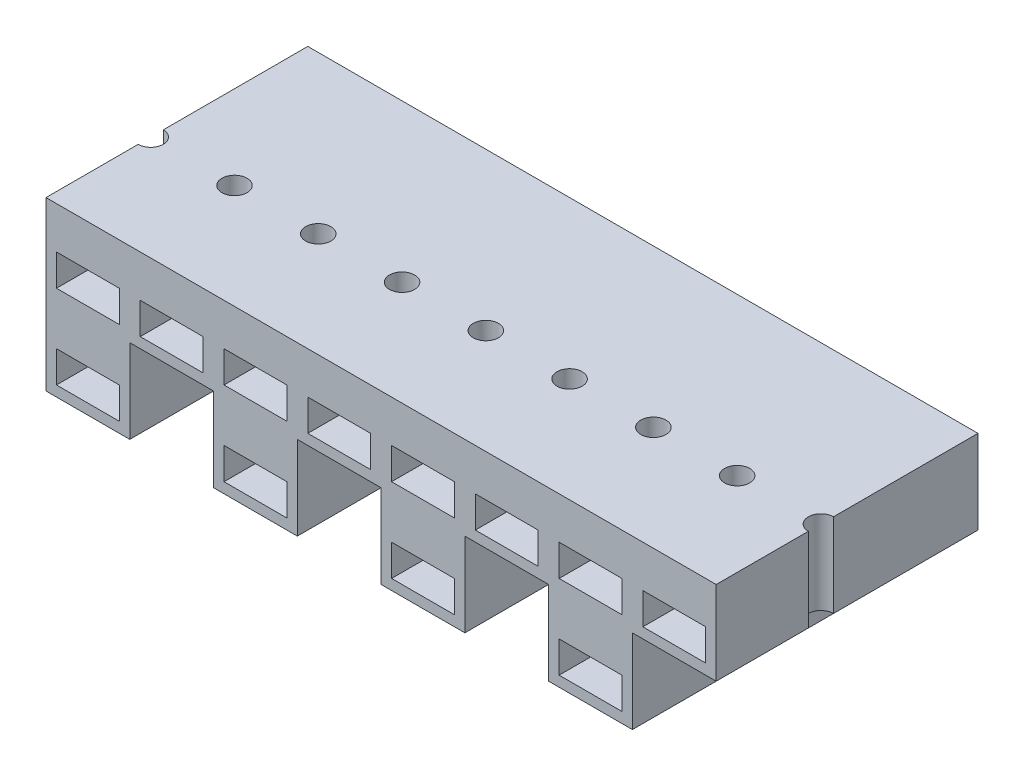
from build123d import *

# Parameters (mm, degrees)
BOSS_EXTRUDE1_DEPTH      = 10
BOSS_EXTRUDE1_DEPTH_BACK = 15
SKETCH2_R                = 1.2
CUT_EXTRUDE1_DEPTH       = 39.794329483
LPATTERN1_COUNT          = 9
LPATTERN1_PITCH          = 8
CUT_EXTRUDE2_START       = -10
SKETCH3_W                = 6
SKETCH3_H                = 3
CUT_EXTRUDE2_DEPTH       = 10
LPATTERN2_COUNT          = 8
LPATTERN2_PITCH          = 8
LPATTERN2_COUNT_DIR2     = 2
LPATTERN2_PITCH_DIR2     = 8


with BuildPart() as part:
    # Sketch1 → Boss-Extrude1 (new, two sides: drawn at the far end of the back side and taken through both)
    with BuildSketch(Plane.XY.offset(-BOSS_EXTRUDE1_DEPTH_BACK)):
        Polygon((-32, 0), (32, 0), (32, -8), (24, -8), (24, -16), (16, -16), (16, -8), (8, -8), (8, -16), (0, -16), (0, -8), (-8, -8), (-8, -16), (-16, -16), (-16, -8), (-24, -8), (-24, -16), (-32, -16), align=None)
    extrude(amount=BOSS_EXTRUDE1_DEPTH + BOSS_EXTRUDE1_DEPTH_BACK)

    # Sketch2 → Cut-Extrude1 (cut, through all)
    with BuildSketch(Plane(origin=(0, 0, 0), x_dir=(1, 0, 0), z_dir=(0, 1, 0))):
        with Locations((-32, 0)):
            Circle(SKETCH2_R)
    cut_extrude1 = extrude(amount=-CUT_EXTRUDE1_DEPTH, mode=Mode.SUBTRACT)

    # LPattern1: Cut-Extrude1 ×9
    with Locations(*[(i * LPATTERN1_PITCH, 0, 0) for i in range(1, LPATTERN1_COUNT)]):
        add(cut_extrude1, mode=Mode.SUBTRACT)

    # Sketch3 → Cut-Extrude2 (cut)
    with BuildSketch(Plane.XY.offset(10).offset(CUT_EXTRUDE2_START)):
        with Locations((-28, -5.5)):
            Rectangle(SKETCH3_W, SKETCH3_H)
    cut_extrude2 = extrude(amount=CUT_EXTRUDE2_DEPTH, mode=Mode.SUBTRACT)

    # LPattern2: Cut-Extrude2 8 × 2
    with Locations(*[(i * LPATTERN2_PITCH, -j * LPATTERN2_PITCH_DIR2, 0) for i in range(LPATTERN2_COUNT) for j in range(LPATTERN2_COUNT_DIR2) if (i, j) != (0, 0)]):
        add(cut_extrude2, mode=Mode.SUBTRACT)


solid = part.part
